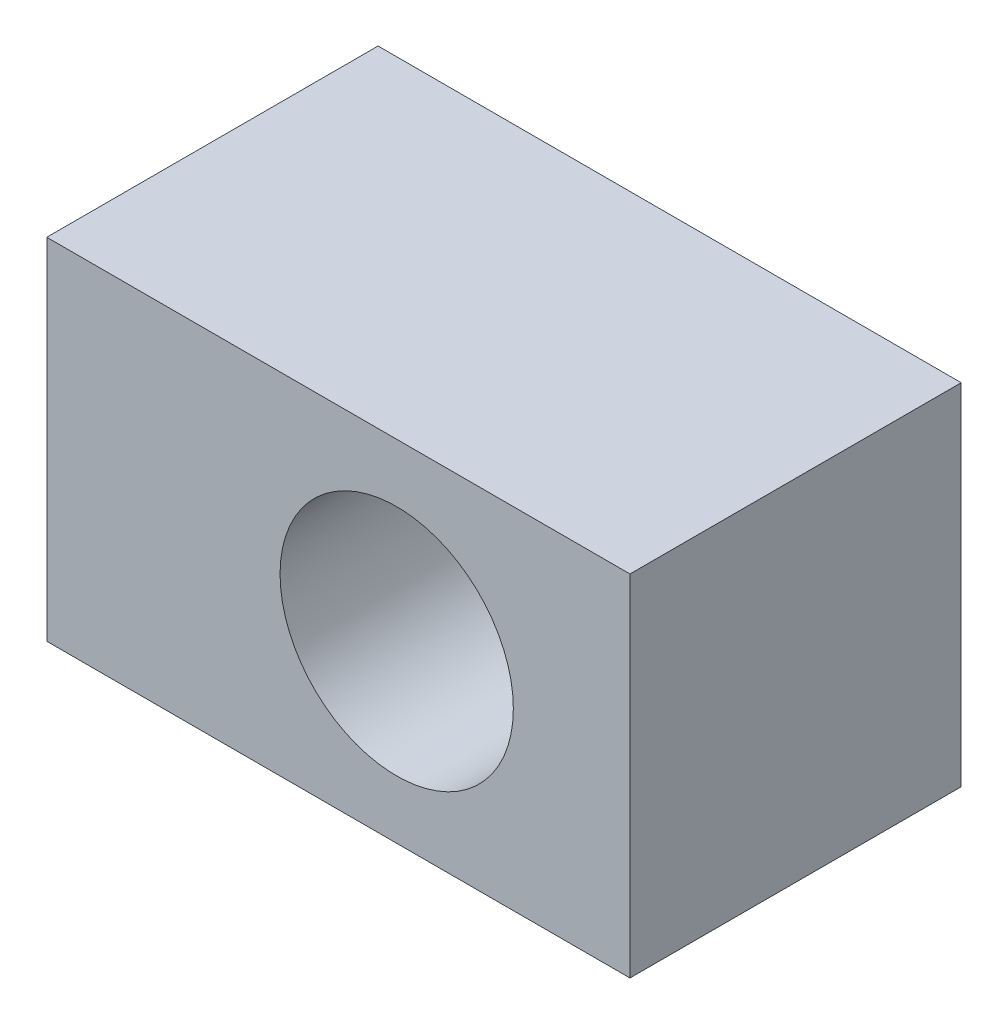
from build123d import *

# Parameters (mm, degrees)
SKETCH1_W           = 127
SKETCH1_H           = 76.2
BOSS_EXTRUDE1_DEPTH = 72.136
SKETCH2_R           = 25.4
CUT_EXTRUDE1_DEPTH  = 165.739316789


with BuildPart() as part:
    # Sketch1 → Boss-Extrude1 (new body)
    with BuildSketch(Plane.XY):
        with Locations((63.5, 38.1)):
            Rectangle(SKETCH1_W, SKETCH1_H)
    extrude(amount=BOSS_EXTRUDE1_DEPTH)

    # Sketch2 → Cut-Extrude1 (cut, through all)
    with BuildSketch(Plane.XY.offset(72.136)):
        with Locations((76.2, 38.1)):
            Circle(SKETCH2_R)
    extrude(amount=-CUT_EXTRUDE1_DEPTH, mode=Mode.SUBTRACT)


solid = part.part
